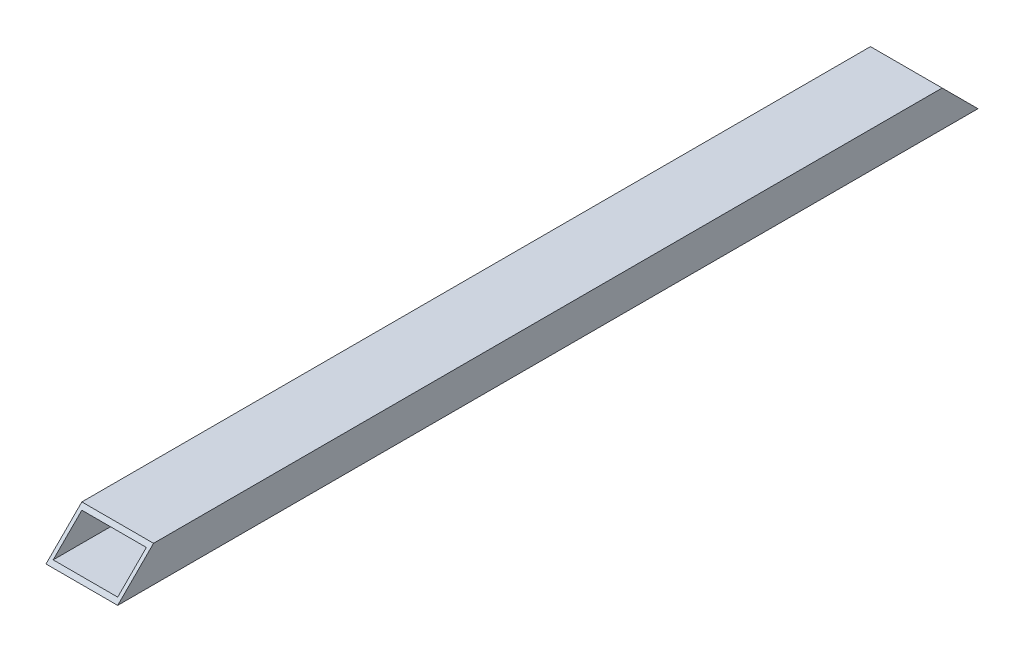
from build123d import *

# Parameters (mm, degrees)
SKETCH1_W           = 40
SKETCH1_H           = 20
SKETCH1_W_2         = 36
SKETCH1_H_2         = 16
BOSS_EXTRUDE1_DEPTH = 480
CUT_EXTRUDE1_DEPTH  = 483.078831728


with BuildPart() as part:
    # Sketch1 → Boss-Extrude1 (new body)
    with BuildSketch(Plane.XY):
        with Locations((20, -10)):
            Rectangle(SKETCH1_W, SKETCH1_H)
        with Locations((20, -10)):
            Rectangle(SKETCH1_W_2, SKETCH1_H_2, mode=Mode.SUBTRACT)
    extrude(amount=BOSS_EXTRUDE1_DEPTH)

    # Sketch2 → Cut-Extrude1 (cut, through all)
    with BuildSketch(Plane(origin=(40, 0, 0), x_dir=(0, 0, -1), z_dir=(1, 0, 0))):
        Polygon((-480, -20), (-460, 0), (-480, 0), align=None)
        Polygon((-20, 0), (0, 0), (0, -20), align=None)
    extrude(amount=-CUT_EXTRUDE1_DEPTH, mode=Mode.SUBTRACT)


solid = part.part
